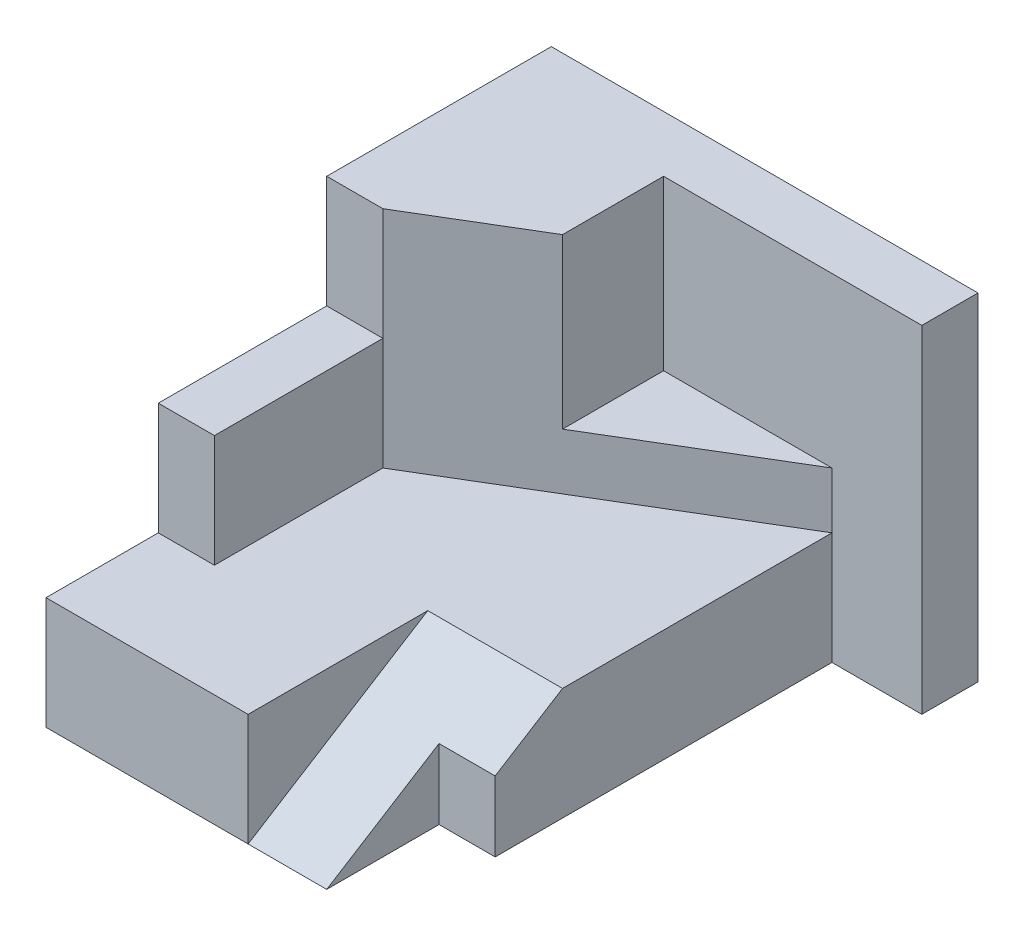
from build123d import *

# Parameters (mm, degrees)
BOSS_EXTRUDE1_DEPTH = 30
SKETCH2_W           = 30
SKETCH2_H           = 45
BOSS_EXTRUDE2_DEPTH = 10
SKETCH3_W           = 15
SKETCH3_H           = 10
BOSS_EXTRUDE3_DEPTH = 5
CUT_EXTRUDE1_DEPTH  = 15
CUT_EXTRUDE2_DEPTH  = 12
SKETCH6_W           = 5
SKETCH6_H           = 10
CUT_EXTRUDE4_DEPTH  = 67.098411479


with BuildPart() as part:
    # Sketch1 → Boss-Extrude1 (new body)
    with BuildSketch(Plane(origin=(0, 0, 0), x_dir=(1, 0, 0), z_dir=(0, 1, 0))):
        Polygon((0, 0), (38, 0), (38, -5), (30, -5), (5, -20), (0, -20), align=None)
    extrude(amount=BOSS_EXTRUDE1_DEPTH)

    # Sketch2 → Boss-Extrude2 (add)
    with BuildSketch(Plane(origin=(0, 0, 0), x_dir=(1, 0, 0), z_dir=(0, 1, 0))):
        with Locations((15, -22.5)):
            Rectangle(SKETCH2_W, SKETCH2_H)
    extrude(amount=BOSS_EXTRUDE2_DEPTH)

    # Sketch3 → Boss-Extrude3 (add)
    with BuildSketch(Plane(origin=(0, 0, 0), x_dir=(0, 0, -1), z_dir=(1, 0, 0))):
        with Locations((-27.5, 15)):
            Rectangle(SKETCH3_W, SKETCH3_H)
    extrude(amount=BOSS_EXTRUDE3_DEPTH)

    # Sketch4 → Cut-Extrude1 (cut)
    with BuildSketch(Plane(origin=(0, 30, 0), x_dir=(1, 0, 0), z_dir=(0, 1, 0))):
        Polygon((30, -5), (15, -5), (15, -14), align=None)
    extrude(amount=-CUT_EXTRUDE1_DEPTH, mode=Mode.SUBTRACT)

    # Sketch5 → Cut-Extrude2 (cut)
    with BuildSketch(Plane(origin=(30, 0, 0), x_dir=(0, 0, -1), z_dir=(1, 0, 0))):
        Polygon((-45, 10), (-45, 0), (-29, 10), align=None)
    extrude(amount=-CUT_EXTRUDE2_DEPTH, mode=Mode.SUBTRACT)

    # Sketch6 → Cut-Extrude4 (cut, through all)
    with BuildSketch(Plane(origin=(0, 0, 0), x_dir=(1, 0, 0), z_dir=(0, 1, 0))):
        with Locations((27.5, -40)):
            Rectangle(SKETCH6_W, SKETCH6_H)
    extrude(amount=CUT_EXTRUDE4_DEPTH, mode=Mode.SUBTRACT)


solid = part.part
